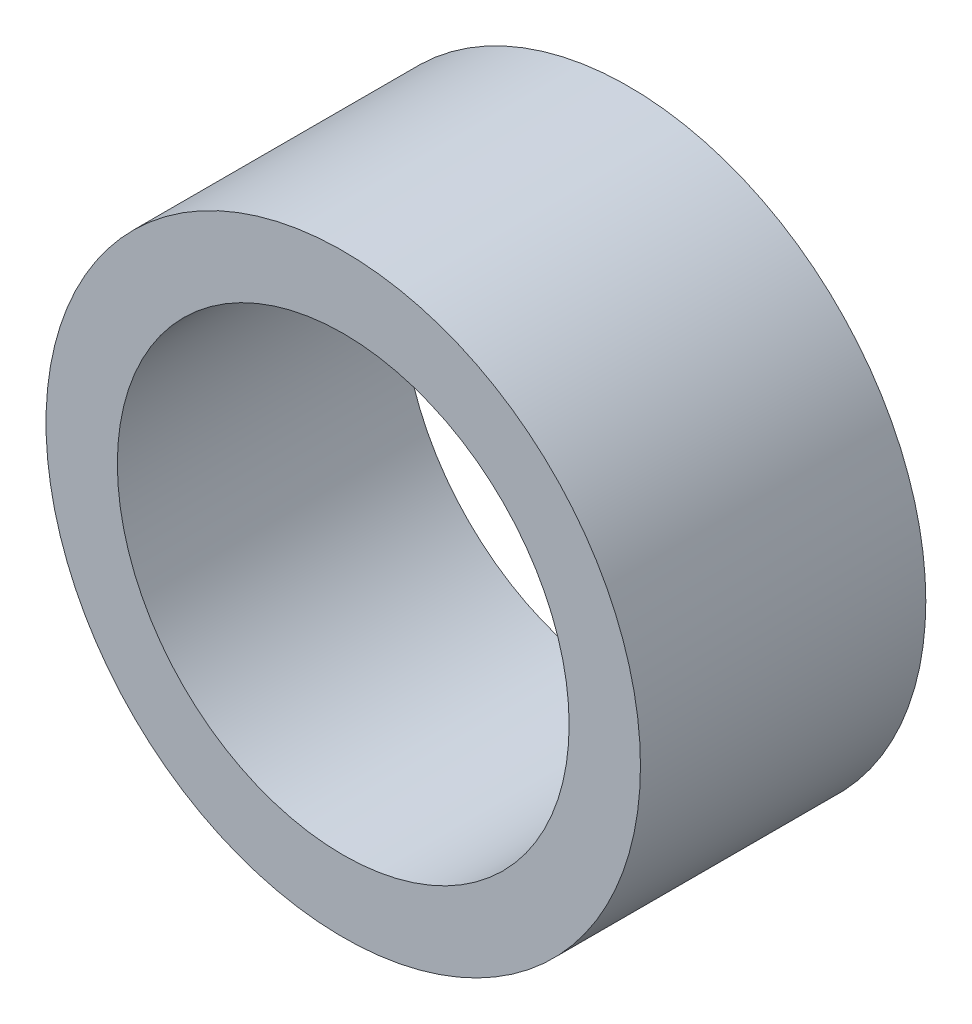
from build123d import *

# Parameters (mm, degrees)
SKETCH_1_R      = 2.5
SKETCH_1_R_2    = 1.9
EXTRUDE_1_DEPTH = 2.4


with BuildPart() as part:
    # ｽｹｯﾁ1 → ﾎﾞｽ - 押し出し1 (new body)
    with BuildSketch(Plane.XY):
        Circle(SKETCH_1_R)
        Circle(SKETCH_1_R_2, mode=Mode.SUBTRACT)
    extrude(amount=EXTRUDE_1_DEPTH)


solid = part.part
